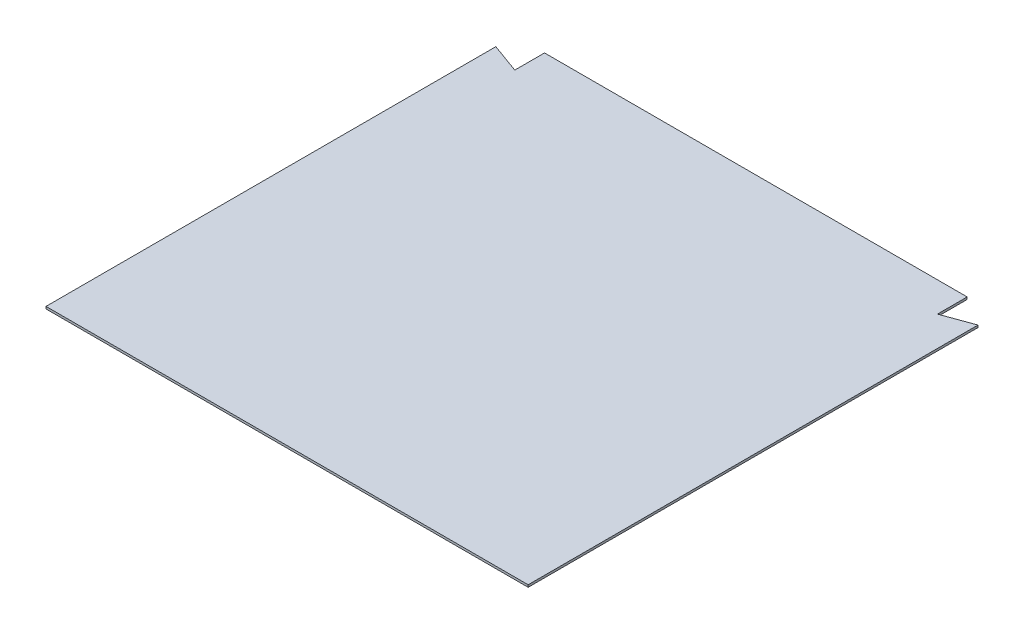
from build123d import *

# Parameters (mm, degrees)
SKETCH1_W            = 284
SKETCH1_H            = 295
BOSS_EXTRUDE1_DEPTH  = 1.5
SKETCH9_W            = 295
SKETCH9_H            = 1.5
BOSS_EXTRUDE9_DEPTH  = 20
SKETCH10_W           = 295
SKETCH10_H           = 1.5
BOSS_EXTRUDE10_DEPTH = 20
SKETCH13_W           = 284
SKETCH13_H           = 20
BOSS_EXTRUDE11_DEPTH = 1.5
BOSS_EXTRUDE12_DEPTH = 1.5


with BuildPart() as part:
    # Sketch1 → Boss-Extrude1 (new body)
    with BuildSketch(Plane(origin=(0, 0, 0), x_dir=(1, 0, 0), z_dir=(0, 1, 0))):
        Rectangle(SKETCH1_W, SKETCH1_H)
    extrude(amount=BOSS_EXTRUDE1_DEPTH)

    # Sketch9 → Boss-Extrude9 (add)
    with BuildSketch(Plane.ZY.offset(142)):
        with Locations((0, 0.75)):
            Rectangle(SKETCH9_W, SKETCH9_H)
    extrude(amount=BOSS_EXTRUDE9_DEPTH)

    # Sketch10 → Boss-Extrude10 (add)
    with BuildSketch(Plane(origin=(142, 0, 0), x_dir=(0, 0, -1), z_dir=(1, 0, 0))):
        with Locations((0, 0.75)):
            Rectangle(SKETCH10_W, SKETCH10_H)
    extrude(amount=BOSS_EXTRUDE10_DEPTH)

    # Sketch13 → Boss-Extrude11 (add)
    with BuildSketch(Plane(origin=(0, 1.5, 0), x_dir=(1, 0, 0), z_dir=(0, 1, 0))):
        with Locations((0, 157.5)):
            Rectangle(SKETCH13_W, SKETCH13_H)
    extrude(amount=-BOSS_EXTRUDE11_DEPTH)

    # Sketch14 → Boss-Extrude12 (add)
    with BuildSketch(Plane(origin=(0, 1.5, 0), x_dir=(1, 0, 0), z_dir=(0, 1, 0))):
        Polygon((142, 147.5), (162, 154.779404685), (162, 147.5), align=None)
        Polygon((-142, 147.5), (-162, 147.5), (-162, 154.779404685), align=None)
    extrude(amount=-BOSS_EXTRUDE12_DEPTH)


solid = part.part
